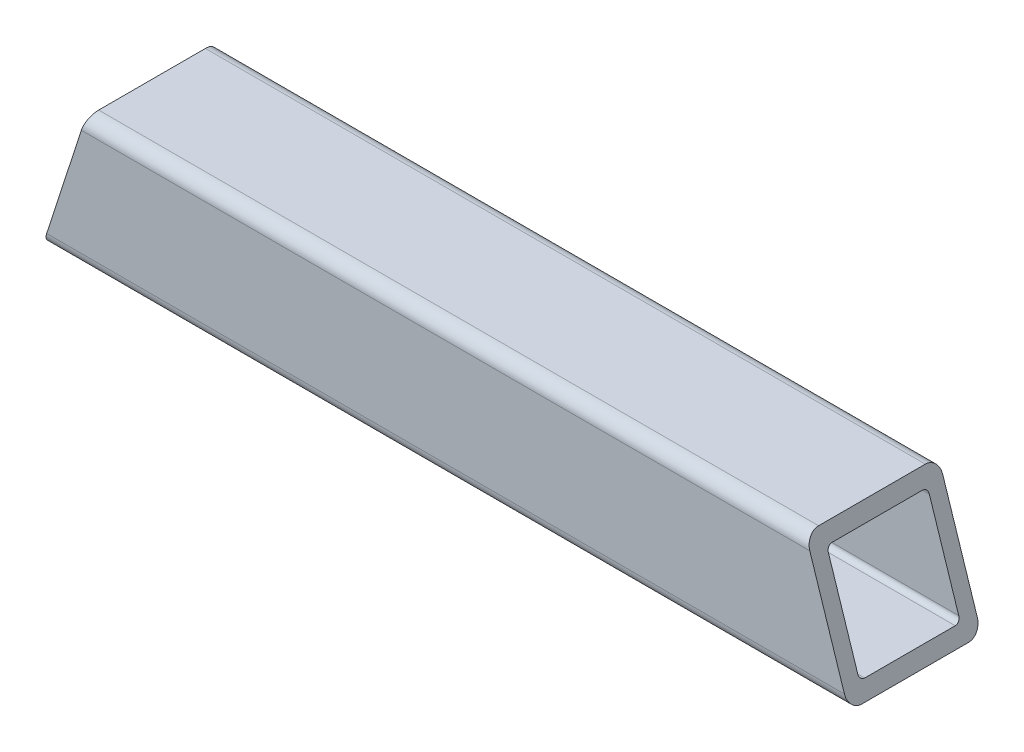
from build123d import *

# Parameters (mm, degrees)
SKETCH3_W           = 25.4
SKETCH3_H           = 25.4
SKETCH3_W_2         = 19.304
SKETCH3_H_2         = 19.304
BOSS_EXTRUDE1_DEPTH = 154.14
FILLET1_R           = 2.5
FILLET2_R           = 1
CUT_EXTRUDE2_DEPTH  = 157.734136677


with BuildPart() as part:
    # Sketch3 → Boss-Extrude1 (new body)
    with BuildSketch(Plane(origin=(0, 0, 0), x_dir=(0, 0, -1), z_dir=(1, 0, 0))):
        Rectangle(SKETCH3_W, SKETCH3_H)
        Rectangle(SKETCH3_W_2, SKETCH3_H_2, mode=Mode.SUBTRACT)
    extrude(amount=-BOSS_EXTRUDE1_DEPTH)

    # Fillet1
    fillet1_edges = [part.edges().sort_by_distance(p)[0] for p in [
        (-77.07, -12.7, -12.7),
        (-77.07, -12.7, 12.7),
        (-77.07, 12.7, 12.7),
        (-77.07, 12.7, -12.7),
    ]]
    fillet(fillet1_edges, radius=FILLET1_R)

    # Fillet2
    fillet2_edges = [part.edges().sort_by_distance(p)[0] for p in [
        (-77.07, 9.652, -9.652),
        (-77.07, -9.652, -9.652),
        (-77.07, -9.652, 9.652),
        (-77.07, 9.652, 9.652),
    ]]
    fillet(fillet2_edges, radius=FILLET2_R)

    # Sketch5 → Cut-Extrude2 (cut, through all)
    with BuildSketch(Plane(origin=(0, 0, -12.7), x_dir=(-1, 0, 0), z_dir=(0, 0, -1))):
        Polygon((0, 10.2), (7.440661044, 10.2), (8.252960284, 12.7), (0, 12.7), align=None)
        Polygon((0.812299241, -10.2), (7.440661044, 10.2), (0, 10.2), (0, -10.2), align=None)
        Polygon((0, -12.7), (0.812299241, -10.2), (0, -10.2), align=None)
        Polygon((154.14, 10.2), (146.699338956, 10.2), (153.327700759, -10.2), (154.14, -10.2), align=None)
        Polygon((154.14, -10.2), (153.327700759, -10.2), (154.14, -12.7), align=None)
        Polygon((154.14, 12.7), (145.887039716, 12.7), (146.699338956, 10.2), (154.14, 10.2), align=None)
    extrude(amount=-CUT_EXTRUDE2_DEPTH, mode=Mode.SUBTRACT)


solid = part.part
